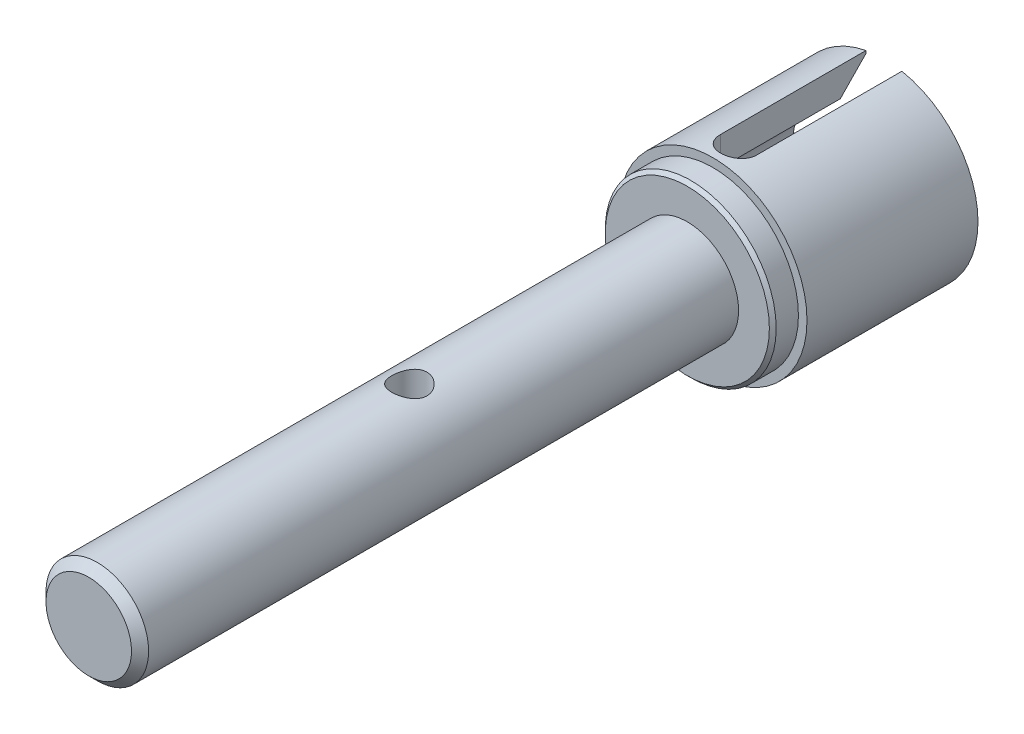
from build123d import *

# Parameters (mm, degrees)
SKETCH_1_R           = 11
EXTRUDE_1_DEPTH      = 29
SKETCH_2_OUTSIDE_W   = 32.506
SKETCH_2_OUTSIDE_H   = 32.506
SKETCH_2_OUTSIDE_R   = 10
CUT_EXTRUDE_1_DEPTH  = 9
SKETCH_3_R           = 7.7
CUT_EXTRUDE_2_DEPTH  = 20
SKETCH_4_R           = 2.1
CUT_EXTRUDE_3_DEPTH  = 25
CHAMFER_1_SIZE       = 3
EXTRUDE_START        = 10
SKETCH_5_R           = 10
EXTRUDE_2_DEPTH      = 10
CUT_EXTRUDE_5_DEPTH  = 19
CUT_EXTRUDE_6_DEPTH  = 19
CHAMFER_2_SIZE       = 0.4
SKETCH_12_R          = 10
CUT_EXTRUDE_9_DEPTH  = 16
SKETCH_13_R          = 4.1
CUT_EXTRUDE_10_DEPTH = 3
CHAMFER_3_SIZE       = 0.4
SKETCH_15_R          = 4.1
EXTRUDE_3_DEPTH      = 3
SKETCH_16_R          = 6
EXTRUDE_4_DEPTH      = 70
CHAMFER_4_SIZE       = 1
SKETCH_17_R          = 2.05
CUT_EXTRUDE_12_DEPTH = 35


with BuildPart() as part:
    # 草图1 → 凸台-拉伸1 (new body)
    with BuildSketch(Plane.XY):
        with Locations(Location((0, 0, 0), (0, 0, 180))):
            Circle(SKETCH_1_R)
    extrude(amount=EXTRUDE_1_DEPTH)

    # 草图2 outside → 切除-拉伸1 (cut)
    with BuildSketch(Plane.XY.offset(29)):
        Rectangle(SKETCH_2_OUTSIDE_W, SKETCH_2_OUTSIDE_H)
        Circle(SKETCH_2_OUTSIDE_R, mode=Mode.SUBTRACT)
    extrude(amount=-CUT_EXTRUDE_1_DEPTH, mode=Mode.SUBTRACT)

    # 草图3 → 切除-拉伸2 (cut)
    with BuildSketch(Plane(origin=(0, 0, 0), x_dir=(-1, 0, 0), z_dir=(0, 0, -1))):
        Circle(SKETCH_3_R)
    extrude(amount=-CUT_EXTRUDE_2_DEPTH, mode=Mode.SUBTRACT)

    # 草图4 → 切除-拉伸3 (cut, symmetric)
    with BuildSketch(Plane(origin=(0, 0, 0), x_dir=(1, 0, 0), z_dir=(0, 1, 0))):
        with BuildLine():
            Line((-2.1, 0), (-2.1, -17))
            ThreePointArc((-2.1, -17), (0, -14.9), (2.1, -17))
            Line((2.1, -17), (2.1, 0))
            Line((2.1, 0), (-2.1, 0))
        make_face()
        with Locations((0, -17)):
            Circle(SKETCH_4_R)
    extrude(amount=CUT_EXTRUDE_3_DEPTH, both=True, mode=Mode.SUBTRACT)

    # 倒角1
    chamfer_1_edges = [part.edges().sort_by_distance(p)[0] for p in [
        (7.7, 0, 0),
        (-6.142475071, -4.643274706, 0),
    ]]
    chamfer(chamfer_1_edges, length=CHAMFER_1_SIZE)

    # 草图5 → 凸台-拉伸2 (add)
    with BuildSketch(Plane.XY.offset(29).offset(EXTRUDE_START)):
        Circle(SKETCH_5_R)
    extrude(amount=-EXTRUDE_2_DEPTH)

    # 草图6 → 切除-拉伸5 (cut)
    with BuildSketch(Plane.XY.offset(39)):
        with BuildLine():
            Line((3.122498999, 2.5), (-3.122498999, 2.5))
            ThreePointArc((-3.122498999, 2.5), (-1.324764885, -3.774254628), (4, 0))
            ThreePointArc((4, 0), (3.774254628, 1.324764885), (3.122498999, 2.5))
        make_face()
    extrude(amount=-CUT_EXTRUDE_5_DEPTH, mode=Mode.SUBTRACT)

    # 草图7 → 切除-拉伸6 (cut)
    with BuildSketch(Plane.XY.offset(39)):
        with BuildLine():
            Line((3.170173497, 2.6), (-3.170173497, 2.6))
            ThreePointArc((-3.170173497, 2.6), (0, -4.1), (3.170173497, 2.6))
        make_face()
    extrude(amount=-CUT_EXTRUDE_6_DEPTH, mode=Mode.SUBTRACT)

    # 倒角2
    chamfer_2_edges = [part.edges().sort_by_distance(p)[0] for p in [
        (0, -4.1, 39),
        (0, 2.6, 39),
    ]]
    chamfer(chamfer_2_edges, length=CHAMFER_2_SIZE)

    # 草图12 → 切除-拉伸9 (cut)
    with BuildSketch(Plane.XY.offset(39)):
        Circle(SKETCH_12_R)
    extrude(amount=-CUT_EXTRUDE_9_DEPTH, mode=Mode.SUBTRACT)

    # 草图13 → 切除-拉伸10 (cut)
    with BuildSketch(Plane.XY.offset(23)):
        Circle(SKETCH_13_R)
    extrude(amount=-CUT_EXTRUDE_10_DEPTH, mode=Mode.SUBTRACT)

    # 倒角3
    chamfer_3_edges = [part.edges().sort_by_distance(p)[0] for p in [
        (-10, 0, 23),
    ]]
    chamfer(chamfer_3_edges, length=CHAMFER_3_SIZE)

    # 草图15 → 凸台-拉伸3 (add)
    with BuildSketch(Plane.XY.offset(23)):
        Circle(SKETCH_15_R)
    extrude(amount=-EXTRUDE_3_DEPTH)

    # 草图16 → 凸台-拉伸4 (add)
    with BuildSketch(Plane.XY.offset(23)):
        Circle(SKETCH_16_R)
    extrude(amount=EXTRUDE_4_DEPTH)

    # 倒角4
    chamfer_4_edges = [part.edges().sort_by_distance(p)[0] for p in [
        (-6, 0, 93),
    ]]
    chamfer(chamfer_4_edges, length=CHAMFER_4_SIZE)

    # 草图17 → 切除-拉伸12 (cut, symmetric)
    with BuildSketch(Plane(origin=(0, 0, 0), x_dir=(1, 0, 0), z_dir=(0, 1, 0))):
        with Locations(Location((0, -55.5, 0), (0, 0, 270))):
            Circle(SKETCH_17_R)
    extrude(amount=CUT_EXTRUDE_12_DEPTH, both=True, mode=Mode.SUBTRACT)


solid = part.part
